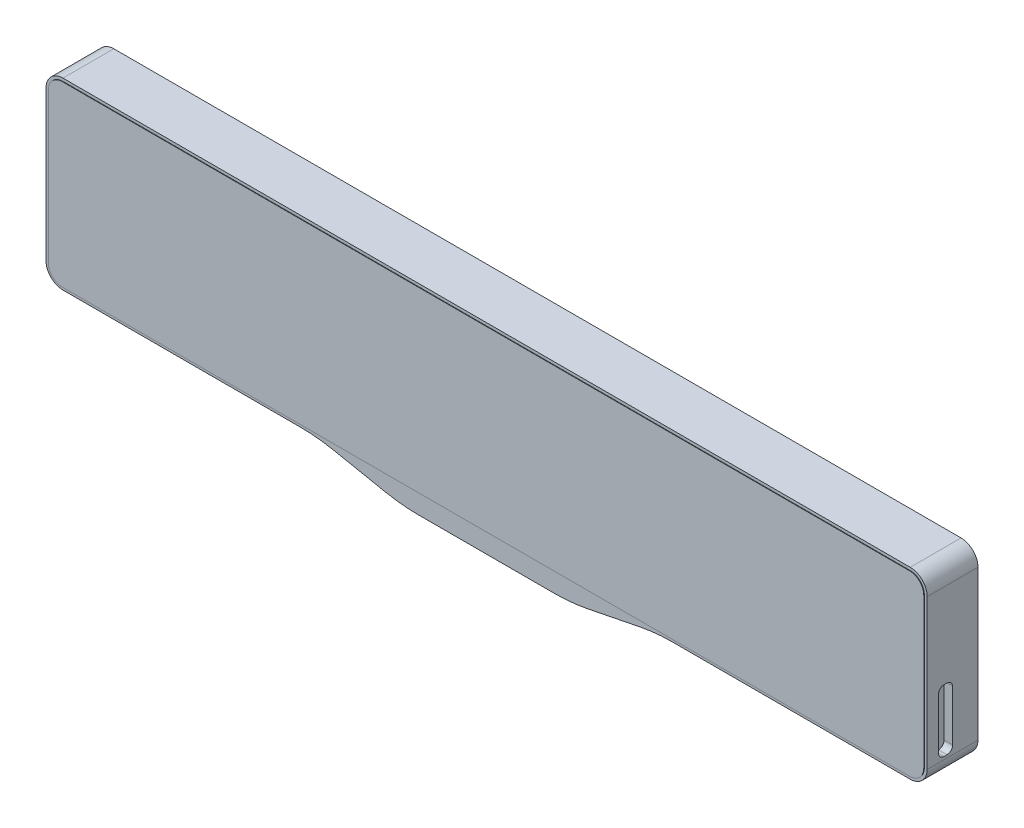
from build123d import *

# Parameters (mm, degrees)
BOSS_EXTRUDE1_DEPTH = 9
FILLET1_R           = 30
FILLET2_R           = 3
BOSS_EXTRUDE2_DEPTH = 0.1
SKETCH3_R           = 1.2
CUT_EXTRUDE1_DEPTH  = 5
SKETCH4_W           = 3.5
SKETCH4_H           = 14.5
CUT_EXTRUDE2_DEPTH  = 1.5
SKETCH5_W           = 2.5
SKETCH5_H           = 11
CUT_EXTRUDE4_DEPTH  = 1.5
FILLET3_R           = 1


with BuildPart() as part:
    # Sketch1 → Boss-Extrude1 (new body)
    with BuildSketch(Plane.XY):
        Polygon((78, -16.25), (78, 16.25), (-78, 16.25), (-78, -16.25), (-30, -16.25), (-15, -19.25), (15, -19.25), (30, -16.25), align=None)
    extrude(amount=BOSS_EXTRUDE1_DEPTH)

    # Fillet1
    fillet1_edges = [part.edges().sort_by_distance(p)[0] for p in [
        (30, -16.25, 4.5),
        (15, -19.25, 4.5),
        (-15, -19.25, 4.5),
        (-30, -16.25, 4.5),
    ]]
    fillet(fillet1_edges, radius=FILLET1_R)

    # Fillet2
    fillet2_edges = [part.edges().sort_by_distance(p)[0] for p in [
        (-78, 16.25, 4.5),
        (78, 16.25, 4.5),
        (78, -16.25, 4.5),
        (-78, -16.25, 4.5),
    ]]
    fillet(fillet2_edges, radius=FILLET2_R)

    # Sketch2 → Boss-Extrude2 (add)
    with BuildSketch(Plane.XY.offset(9)):
        with BuildLine():
            Line((-32.970585408, -15.75), (32.970585408, -15.75))
            Line((32.970585408, -15.75), (75, -15.75))
            ThreePointArc((75, -15.75), (76.767766953, -15.017766953), (77.5, -13.25))
            Line((77.5, -13.25), (77.5, 13.25))
            ThreePointArc((77.5, 13.25), (76.767766953, 15.017766953), (75, 15.75))
            Line((75, 15.75), (-75, 15.75))
            ThreePointArc((-75, 15.75), (-76.767766953, 15.017766953), (-77.5, 13.25))
            Line((-77.5, 13.25), (-77.5, -13.25))
            ThreePointArc((-77.5, -13.25), (-76.767766953, -15.017766953), (-75, -15.75))
            Line((-75, -15.75), (-32.970585408, -15.75))
        make_face()
    extrude(amount=BOSS_EXTRUDE2_DEPTH)

    # Sketch3 → Cut-Extrude1 (cut)
    with BuildSketch(Plane.XZ.offset(19.25)):
        with Locations((-9, 4.5)):
            Circle(SKETCH3_R)
        with Locations(Location((9, 4.5, 0), (0, 0, 180))):
            Circle(SKETCH3_R)
    extrude(amount=-CUT_EXTRUDE1_DEPTH, mode=Mode.SUBTRACT)

    # Sketch4 → Cut-Extrude2 (cut)
    with BuildSketch(Plane.ZY.offset(78)):
        with Locations((5.75, -1)):
            Rectangle(SKETCH4_W, SKETCH4_H)
    extrude(amount=-CUT_EXTRUDE2_DEPTH, mode=Mode.SUBTRACT)

    # Sketch5 → Cut-Extrude4 (cut)
    with BuildSketch(Plane(origin=(78, 0, 0), x_dir=(0, 0, -1), z_dir=(1, 0, 0))):
        with Locations((-5.75, -7.25)):
            Rectangle(SKETCH5_W, SKETCH5_H)
    extrude(amount=-CUT_EXTRUDE4_DEPTH, mode=Mode.SUBTRACT)

    # Fillet3
    fillet3_edges = [part.edges().sort_by_distance(p)[0] for p in [
        (-77.25, -8.25, 4),
        (-77.25, 6.25, 4),
        (-77.25, 6.25, 7.5),
        (-77.25, -8.25, 7.5),
        (77.25, -12.75, 7),
        (77.25, -1.75, 7),
        (77.25, -1.75, 4.5),
        (77.25, -12.75, 4.5),
    ]]
    fillet(fillet3_edges, radius=FILLET3_R)


solid = part.part
